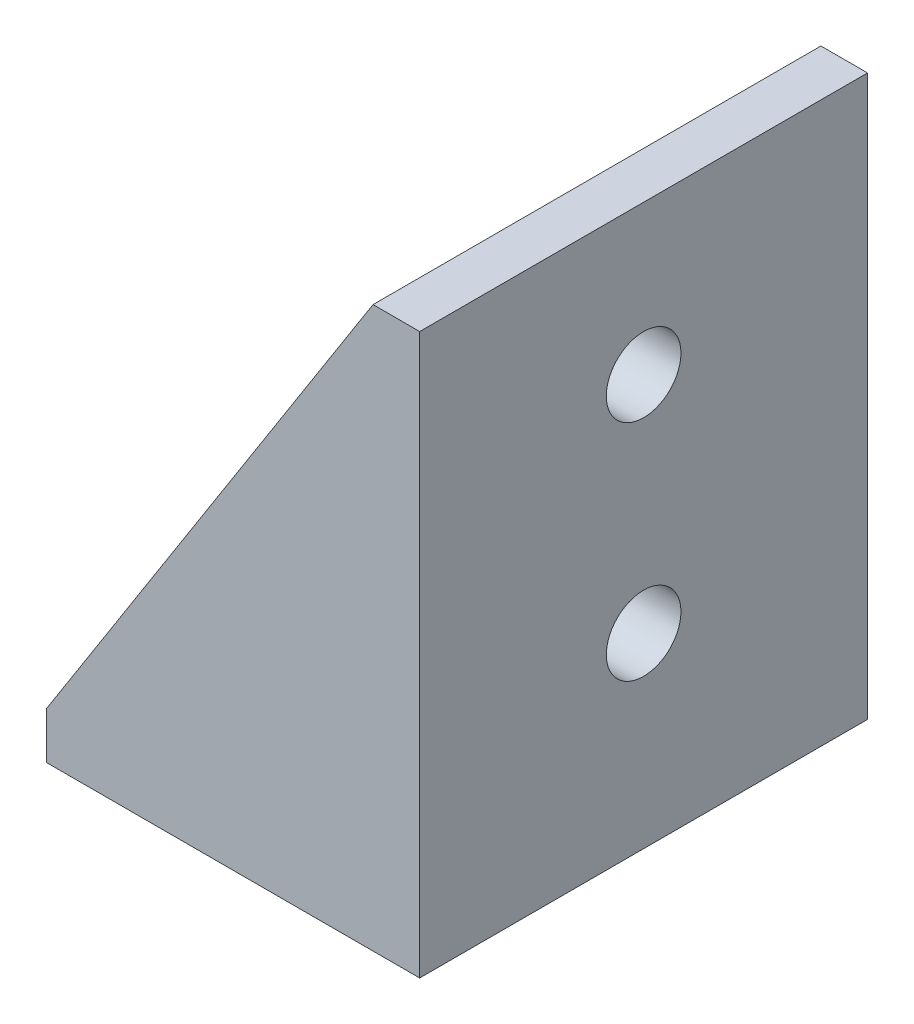
from build123d import *

# Parameters (mm, degrees)
EXTRUDE_1_DEPTH          = 20
CUT_EXTRUDE_START        = 30
SKETCH_2_W               = 17.5
SKETCH_2_H               = 16.6
CUT_EXTRUDE_1_DEPTH      = 27.5
CUT_EXTRUDE_START_2      = 17.5
SKETCH_3_R               = 2
CUT_EXTRUDE_2_DEPTH      = 2.5
EXTRUDE_3_REACH          = 42.434
CUT_EXTRUDE_4_DEPTH      = 42.231056256
CUT_EXTRUDE_4_DEPTH_BACK = 2
SKETCH_3_2_R             = 2
CUT_EXTRUDE_6_DEPTH      = 42.231056256
CUT_EXTRUDE_6_DEPTH_BACK = 9
SKETCH_4_R               = 1.7
SKETCH_7_W               = 15.3
SKETCH_7_H               = 16.6
SKETCH_7_R               = 1.7
EXTRUDE_4_DEPTH          = 2
EXTRUDE_5_DEPTH          = 2
EXTRUDE_START            = -20
EXTRUDE_6_DEPTH          = 2


with BuildPart() as part:
    # 草图1 → 凸台-拉伸1 (new body)
    with BuildSketch(Plane.XY):
        Polygon((0, 0), (20, 0), (20, 30), (17.5, 30), (0, 2.5), align=None)
    extrude(amount=-EXTRUDE_1_DEPTH)

    # 草图2 → 切除-拉伸1 (cut)
    with BuildSketch(Plane(origin=(0, 0, 0), x_dir=(1, 0, 0), z_dir=(0, 1, 0)).offset(CUT_EXTRUDE_START)):
        with Locations((8.75, 10)):
            Rectangle(SKETCH_2_W, SKETCH_2_H)
    extrude(amount=-CUT_EXTRUDE_1_DEPTH, mode=Mode.SUBTRACT)

    # 草图3 → 切除-拉伸2 (cut)
    with BuildSketch(Plane(origin=(0, 0, 0), x_dir=(0, 0, -1), z_dir=(1, 0, 0)).offset(CUT_EXTRUDE_START_2)):
        with Locations(Location((10, 22, 0), (0, 0, 180))):
            Circle(SKETCH_3_R)
        with Locations(Location((10, 10, 0), (0, 0, 180))):
            Circle(SKETCH_3_R)
    extrude(amount=CUT_EXTRUDE_2_DEPTH, mode=Mode.SUBTRACT)

    # 草图6 → 凸台-拉伸3 (add, up to next)
    with BuildSketch(Plane(origin=(0, 0, -1.7), x_dir=(-1, 0, 0), z_dir=(0, 0, -1)), mode=Mode.PRIVATE) as extrude_3_sk1:
        Polygon((-15.3, 26.542857143), (-15.3, 2.5), (-17.5, 2.5), (-17.5, 30), align=None)
    extrude_3_tool1 = extrude(extrude_3_sk1.sketch, amount=EXTRUDE_3_REACH, mode=Mode.PRIVATE) - part.part
    add(extrude_3_tool1.solids().sort_by_distance((16.424593, 15.405038, -1.7))[0])

    # 草图3<2> → 切除-拉伸4 (cut, two sides: drawn at the far end of the back side and taken through both)
    with BuildSketch(Plane(origin=(0, 0, 0), x_dir=(0, 0, -1), z_dir=(1, 0, 0)).offset(-CUT_EXTRUDE_4_DEPTH_BACK)):
        with Locations((10, 22)):
            Circle(SKETCH_3_2_R)
        with Locations((10, 10)):
            Circle(SKETCH_3_2_R)
    extrude(amount=CUT_EXTRUDE_4_DEPTH + CUT_EXTRUDE_4_DEPTH_BACK, mode=Mode.SUBTRACT)

    # 草图4 → 切除-拉伸6 (cut, two sides: drawn at the far end of the back side and taken through both)
    with BuildSketch(Plane(origin=(0, 0, 0), x_dir=(1, 0, 0), z_dir=(0, 1, 0)).offset(-CUT_EXTRUDE_6_DEPTH_BACK)):
        with Locations(Location((9, 10, 0), (0, 0, 90))):
            Circle(SKETCH_4_R)
    extrude(amount=CUT_EXTRUDE_6_DEPTH + CUT_EXTRUDE_6_DEPTH_BACK, mode=Mode.SUBTRACT)

    # 草图7 → 凸台-拉伸4 (add)
    with BuildSketch(Plane(origin=(0, 2.5, 0), x_dir=(1, 0, 0), z_dir=(0, 1, 0))):
        with Locations((7.65, 10)):
            Rectangle(SKETCH_7_W, SKETCH_7_H)
        with Locations(Location((9, 10, 0), (0, 0, 90))):
            Circle(SKETCH_7_R, mode=Mode.SUBTRACT)
    extrude(amount=EXTRUDE_4_DEPTH)

    # 草图8 → 凸台-拉伸5 (add)
    with BuildSketch(Plane(origin=(0, 0, -20), x_dir=(-1, 0, 0), z_dir=(0, 0, -1))):
        Polygon((0, 0), (0, 2.5), (-17.5, 30), (-20, 30), (-20, 0), align=None)
    extrude(amount=EXTRUDE_5_DEPTH)

    # 草图8<2> → 凸台-拉伸6 (add)
    with BuildSketch(Plane(origin=(0, 0, -20), x_dir=(-1, 0, 0), z_dir=(0, 0, -1)).offset(EXTRUDE_START)):
        Polygon((0, 0), (0, 2.5), (-17.5, 30), (-20, 30), (-20, 0), align=None)
    extrude(amount=-EXTRUDE_6_DEPTH)


solid = part.part
